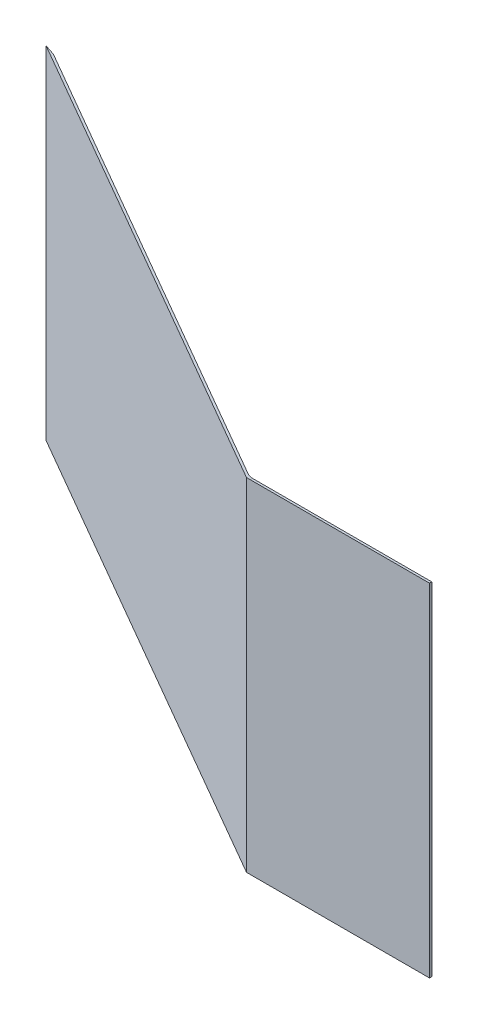
from build123d import *

# Parameters (mm, degrees)
EXTRUDE_1_DEPTH = 10
EXTRUDE_2_DEPTH = 150
FILLET_1_R      = 5
FILLET_2_R      = 5


with BuildPart() as part:
    # 草图1 → 凸台-拉伸1 (new body)
    with BuildSketch(Plane(origin=(0, 0, 0), x_dir=(1, 0, 0), z_dir=(0, 1, 0))):
        Polygon((-84.930519712, 76.342229186), (118.585450177, -41.157770814), (198.585450177, -41.157770814), (198.585450177, -42.157770814), (118.317500985, -42.157770814), (-89.528595923, 77.842229186), align=None)
    extrude(amount=EXTRUDE_1_DEPTH)

    # 草图1<2> → 凸台-拉伸2 (add)
    with BuildSketch(Plane(origin=(0, 0, 0), x_dir=(1, 0, 0), z_dir=(0, 1, 0))):
        Polygon((-84.930519712, 76.342229186), (118.585450177, -41.157770814), (198.585450177, -41.157770814), (198.585450177, -42.157770814), (118.317500985, -42.157770814), (-89.528595923, 77.842229186), align=None)
    extrude(amount=EXTRUDE_2_DEPTH)

    # 圆角1
    fillet_1_edges = [part.edges().sort_by_distance(p)[0] for p in [
        (-84.930519712, 75, -76.342229186),
    ]]
    fillet(fillet_1_edges, radius=FILLET_1_R)

    # 圆角2
    fillet_2_edges = [part.edges().sort_by_distance(p)[0] for p in [
        (118.585450177, 75, 41.157770814),
    ]]
    fillet(fillet_2_edges, radius=FILLET_2_R)


solid = part.part
